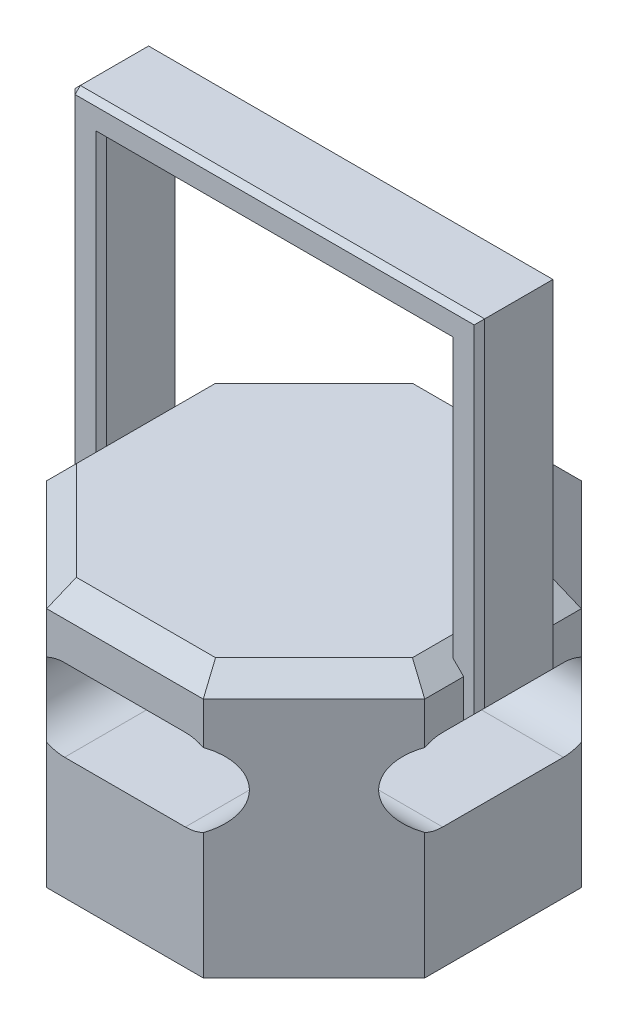
from build123d import *

# Parameters (mm, degrees)
BOSS_EXTRUDE1_DEPTH         = 50
CUT_EXTRUDE1_DEPTH          = 72
CUT_EXTRUDE2_REACH          = 96.763
CHAMFER10_SIZE              = 4
BOSS_EXTRUDE10_DEPTH        = 50
BOSS_EXTRUDE10_DEPTH_BACK   = 11.2
SKETCH18_W                  = 6
SKETCH18_H                  = 15
BOSS_EXTRUDE10_2_DEPTH      = 50
BOSS_EXTRUDE10_2_DEPTH_BACK = 11.2
SKETCH20_W                  = 78
SKETCH20_H                  = 15
BOSS_EXTRUDE11_DEPTH        = 6
CHAMFER8_SIZE               = 3
CHAMFER9_SIZE               = 1


with BuildPart() as part:
    # Sketch1 → Boss-Extrude1 (new body)
    with BuildSketch(Plane(origin=(0, 0, 0), x_dir=(1, 0, 0), z_dir=(0, 1, 0))):
        Polygon((14.911688245, 36), (-14.911688245, 36), (-36, 14.911688245), (-36, -14.911688245), (-14.911688245, -36), (14.911688245, -36), (36, -14.911688245), (36, 14.911688245), align=None)
    extrude(amount=BOSS_EXTRUDE1_DEPTH)

    # Sketch3 → Cut-Extrude1 (cut)
    with BuildSketch(Plane.XY.offset(36)):
        with BuildLine():
            Line((-11.5, 38.8), (11.5, 38.8))
            ThreePointArc((11.5, 38.8), (19.3, 31), (11.5, 23.2))
            Line((11.5, 23.2), (-11.5, 23.2))
            ThreePointArc((-11.5, 23.2), (-19.3, 31), (-11.5, 38.8))
        make_face()
    extrude(amount=-CUT_EXTRUDE1_DEPTH, mode=Mode.SUBTRACT)

    # Cut-Extrude2: up to this face of the body (flat: up to its plane)
    cut_extrude2_end = Plane(part.part.faces().sort_by_distance((36, 25, 0))[0])
    # Sketch4 → Cut-Extrude2 (cut, up to the picked face)
    with BuildSketch(Plane.ZY.offset(36), mode=Mode.PRIVATE) as cut_extrude2_sk1:
        with BuildLine():
            Line((-11.5, 38.8), (11.5, 38.8))
            ThreePointArc((11.5, 38.8), (19.3, 31), (11.5, 23.2))
            Line((11.5, 23.2), (-11.5, 23.2))
            ThreePointArc((-11.5, 23.2), (-19.3, 31), (-11.5, 38.8))
        make_face()
    cut_extrude2_tool1 = split(extrude(cut_extrude2_sk1.sketch, amount=-CUT_EXTRUDE2_REACH, mode=Mode.PRIVATE), bisect_by=cut_extrude2_end, keep=Keep.BOTH, mode=Mode.PRIVATE)
    add(cut_extrude2_tool1.solids().sort_by(Axis((-36, 31, 0), (1, 0, 0)))[0], mode=Mode.SUBTRACT)

    # Chamfer10
    chamfer10_edges = [part.edges().sort_by_distance(p)[0] for p in [
        (-25.455844123, 50, -25.455844123),
        (-36, 50, 0),
        (-25.455844123, 50, 25.455844123),
        (0, 50, 36),
        (25.455844123, 50, 25.455844123),
        (36, 50, 0),
        (25.455844123, 50, -25.455844123),
        (0, 50, -36),
    ]]
    chamfer(chamfer10_edges, length=CHAMFER10_SIZE)


with BuildPart() as body_2:
    # Sketch18 → Boss-Extrude10 (new, two sides: drawn at the far end of the back side and taken through both)
    with BuildSketch(Plane(origin=(0, 50, 0), x_dir=(1, 0, 0), z_dir=(0, 1, 0)).offset(-BOSS_EXTRUDE10_DEPTH_BACK)):
        with Locations((-36, 0)):
            Rectangle(SKETCH18_W, SKETCH18_H)
    extrude(amount=BOSS_EXTRUDE10_DEPTH + BOSS_EXTRUDE10_DEPTH_BACK)



with BuildPart() as body_3:
    # Sketch18 → Boss-Extrude10 2 (new, two sides: drawn at the far end of the back side and taken through both)
    with BuildSketch(Plane(origin=(0, 50, 0), x_dir=(1, 0, 0), z_dir=(0, 1, 0)).offset(-BOSS_EXTRUDE10_2_DEPTH_BACK)):
        with Locations((36, 0)):
            Rectangle(SKETCH18_W, SKETCH18_H)
    extrude(amount=BOSS_EXTRUDE10_2_DEPTH + BOSS_EXTRUDE10_2_DEPTH_BACK)


with BuildPart() as body_2_1:
    add(body_2.part)

    add(body_3.part)  # Boss-Extrude11 merges body 3
    # Sketch20 → Boss-Extrude11 (add)
    with BuildSketch(Plane(origin=(0, 100, 0), x_dir=(1, 0, 0), z_dir=(0, 1, 0))):
        Rectangle(SKETCH20_W, SKETCH20_H)
    extrude(amount=BOSS_EXTRUDE11_DEPTH)

    # Chamfer8
    chamfer8_edges = [body_2_1.edges().sort_by_distance(p)[0] for p in [
        (-39, 38.8, 0),
        (39, 38.8, 0),
    ]]
    chamfer(chamfer8_edges, length=CHAMFER8_SIZE)

    # Chamfer9
    chamfer9_edges = [body_2_1.edges().sort_by_distance(p)[0] for p in [
        (-33, 69.4, 7.5),
        (-33, 69.4, -7.5),
        (0, 100, 7.5),
        (39, 73.9, 7.5),
        (39, 73.9, -7.5),
        (-39, 106, 0),
        (0, 106, 7.5),
        (0, 106, -7.5),
        (0, 100, -7.5),
        (33, 69.4, -7.5),
        (33, 69.4, 7.5),
        (-39, 73.9, 7.5),
        (-39, 73.9, -7.5),
    ]]
    chamfer(chamfer9_edges, length=CHAMFER9_SIZE)


solid = Compound([part.part, body_2_1.part])
